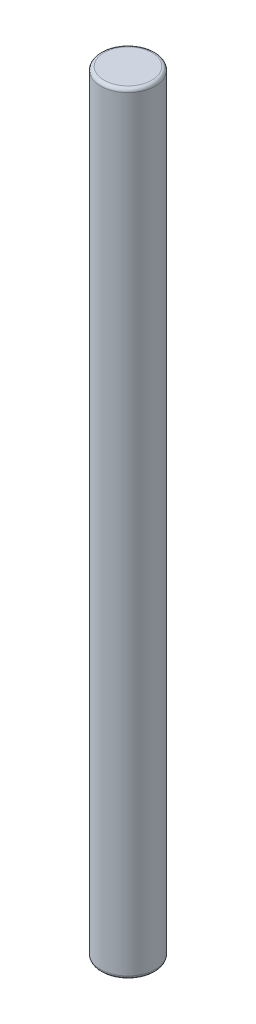
from build123d import *

# Parameters (mm, degrees)
SKETCH1_R           = 4
BOSS_EXTRUDE1_DEPTH = 113
FILLET1_R           = 0.5
FILLET2_R           = 0.5


with BuildPart() as part:
    # Sketch1 → Boss-Extrude1 (new body)
    with BuildSketch(Plane(origin=(0, 0, 0), x_dir=(1, 0, 0), z_dir=(0, 1, 0))):
        with Locations(Location((0, 0, 0), (0, 0, 270))):
            Circle(SKETCH1_R)
    extrude(amount=BOSS_EXTRUDE1_DEPTH)

    # Fillet1
    fillet1_edges = [part.edges().sort_by_distance(p)[0] for p in [
        (0, 113, -4),
    ]]
    fillet(fillet1_edges, radius=FILLET1_R)

    # Fillet2
    fillet2_edges = [part.edges().sort_by_distance(p)[0] for p in [
        (0, 0, -4),
    ]]
    fillet(fillet2_edges, radius=FILLET2_R)


solid = part.part
